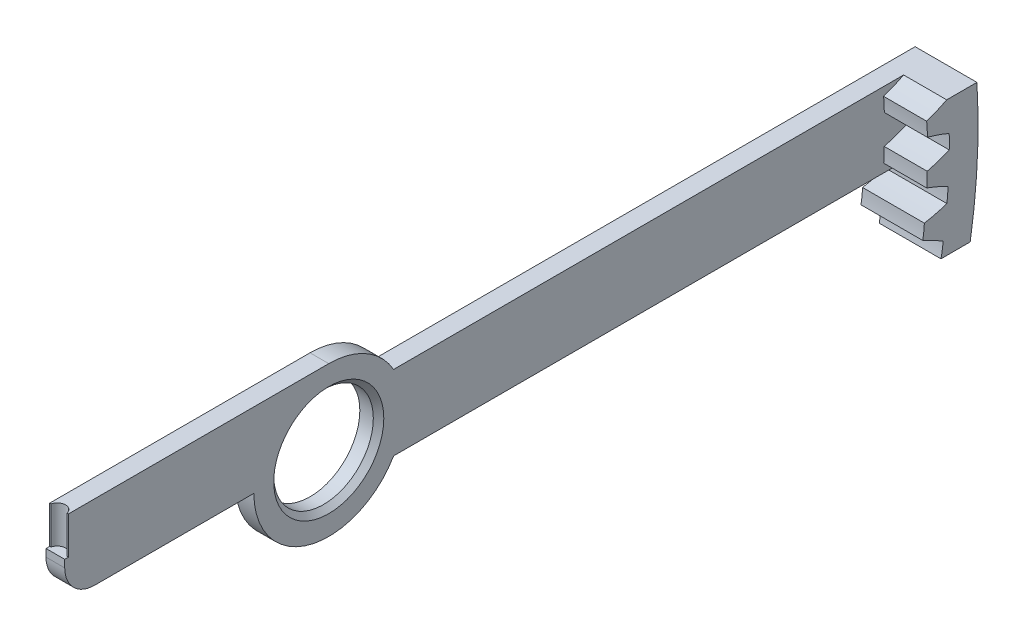
from build123d import *

# Parameters (mm, degrees)
SKETCH_1_R              = 6.65
EXTRUDE_1_DEPTH         = 1.25
EXTRUDE_2_DEPTH         = 7
EXTRUDE_2_DEPTH_BACK    = 1.25
SKETCH_3_R              = 1.1
CUT_EXTRUDE_1_DEPTH     = 5
CHAMFER_1_SIZE          = 0.7
CUT_EXTRUDE1_DEPTH      = 10
CUT_EXTRUDE1_DEPTH_BACK = 10
SKETCH1_W               = 17.330799804
SKETCH1_H               = 10.706669518


with BuildPart() as part:
    # Эскиз1 → Бобышка-Вытянуть1 (new, symmetric)
    with BuildSketch(Plane(origin=(0, 0, 0), x_dir=(0, 0, -1), z_dir=(1, 0, 0))):
        with BuildLine():
            Line((-31.25, 0), (-10, 0))
            ThreePointArc((-10, 0), (-2.588190451, -9.659258263), (8.660254038, -5))
            Line((8.660254038, -5), (76.721847542, -5))
            ThreePointArc((76.721847542, -5), (75.425886146, -4.389181279), (74.09117429, -3.868451302))
            ThreePointArc((74.09117429, -3.868451302), (74.147561595, -2.912548148), (74.149130868, -1.954984622))
            ThreePointArc((74.149130868, -1.954984622), (75.638846987, -1.51744657), (77.087831178, -0.959648686))
            ThreePointArc((77.087831178, -0.959648686), (77.109856091, -0.006099484), (77.083941958, 0.947351948))
            ThreePointArc((77.083941958, 0.947351948), (75.643750299, 1.505844774), (74.166291118, 1.956600379))
            ThreePointArc((74.166291118, 1.956600379), (74.147505302, 2.913980899), (74.073940169, 3.8687157))
            ThreePointArc((74.073940169, 3.8687157), (75.433826566, 4.383081961), (76.750365892, 5))
            Line((76.750365892, 5), (8.660254038, 5))
            ThreePointArc((8.660254038, 5), (5, 8.660254038), (0, 10))
            Line((0, 10), (-34.75, 10))
            Line((-34.75, 10), (-34.75, 5))
            Line((-34.75, 5), (-35.25, 5))
            Line((-35.25, 5), (-35.25, 4))
            ThreePointArc((-35.25, 4), (-34.078427125, 1.171572875), (-31.25, 0))
        make_face()
        Circle(SKETCH_1_R, mode=Mode.SUBTRACT)
    extrude(amount=EXTRUDE_1_DEPTH, both=True)

    # Эскиз1<5> → Бобышка-Вытянуть2 (add, two sides: drawn at the far end of the back side and taken through both)
    with BuildSketch(Plane(origin=(0, 0, 0), x_dir=(0, 0, -1), z_dir=(1, 0, 0)).offset(-EXTRUDE_2_DEPTH_BACK)):
        with BuildLine():
            Line((73.559260736, 9.685830974), (74.227172899, 10))
            Line((74.227172899, 10), (80.32185029, 10))
            ThreePointArc((80.32185029, 10), (80.927765714, -1.515378033), (79.891173693, -13))
            Line((79.891173693, -13), (75.988629927, -13.007027449))
            ThreePointArc((75.988629927, -13.007027449), (76.159551637, -12.068663477), (76.283109214, -11.12289675))
            ThreePointArc((76.283109214, -11.12289675), (74.948016231, -10.345984286), (73.559260736, -9.669652694))
            ThreePointArc((73.559260736, -9.669652694), (73.690473514, -8.721120367), (73.767167518, -7.766631814))
            ThreePointArc((73.767167518, -7.766631814), (75.28662018, -7.447324325), (76.774901953, -7.004931935))
            ThreePointArc((76.774901953, -7.004931935), (76.871673579, -6.056050262), (76.920646267, -5.103504803))
            ThreePointArc((76.920646267, -5.103504803), (75.528713081, -4.433737489), (74.09117429, -3.868451302))
            ThreePointArc((74.09117429, -3.868451302), (74.147561595, -2.912548148), (74.149130868, -1.954984622))
            ThreePointArc((74.149130868, -1.954984622), (75.638846987, -1.51744657), (77.087831178, -0.959648686))
            ThreePointArc((77.087831178, -0.959648686), (77.109856091, -0.006099484), (77.083941958, 0.947351948))
            ThreePointArc((77.083941958, 0.947351948), (75.643750299, 1.505844774), (74.166291118, 1.956600379))
            ThreePointArc((74.166291118, 1.956600379), (74.147505302, 2.913980899), (74.073940169, 3.8687157))
            ThreePointArc((74.073940169, 3.8687157), (75.524735151, 4.421786748), (76.925488289, 5.091551117))
            ThreePointArc((76.925488289, 5.091551117), (76.872630699, 6.043888899), (76.771989513, 6.992367959))
            ThreePointArc((76.771989513, 6.992367959), (75.292418643, 7.436143003), (73.784148097, 7.769588967))
            ThreePointArc((73.784148097, 7.769588967), (73.691130431, 8.729989779), (73.559260736, 9.685830974))
        make_face()
    extrude(amount=EXTRUDE_2_DEPTH + EXTRUDE_2_DEPTH_BACK)

    # Эскиз3 → Вырез-Вытянуть1 (cut)
    with BuildSketch(Plane(origin=(0, 10, 0), x_dir=(1, 0, 0), z_dir=(0, 1, 0))):
        with Locations((0, -35)):
            Circle(SKETCH_3_R)
    extrude(amount=-CUT_EXTRUDE_1_DEPTH, mode=Mode.SUBTRACT)

    # Фаска1
    chamfer_1_edges = [part.edges().sort_by_distance(p)[0] for p in [
        (1.25, 0, 6.65),
    ]]
    chamfer(chamfer_1_edges, length=CHAMFER_1_SIZE)

    # Sketch1 → Cut-Extrude1 (cut, two sides: drawn at the far end of the back side and taken through both)
    with BuildSketch(Plane(origin=(0, 0, 0), x_dir=(0, 0, -1), z_dir=(1, 0, 0)).offset(-CUT_EXTRUDE1_DEPTH_BACK)):
        with Locations((79.197341576, 10.353334759)):
            Rectangle(SKETCH1_W, SKETCH1_H)
    extrude(amount=CUT_EXTRUDE1_DEPTH + CUT_EXTRUDE1_DEPTH_BACK, mode=Mode.SUBTRACT)


solid = part.part
